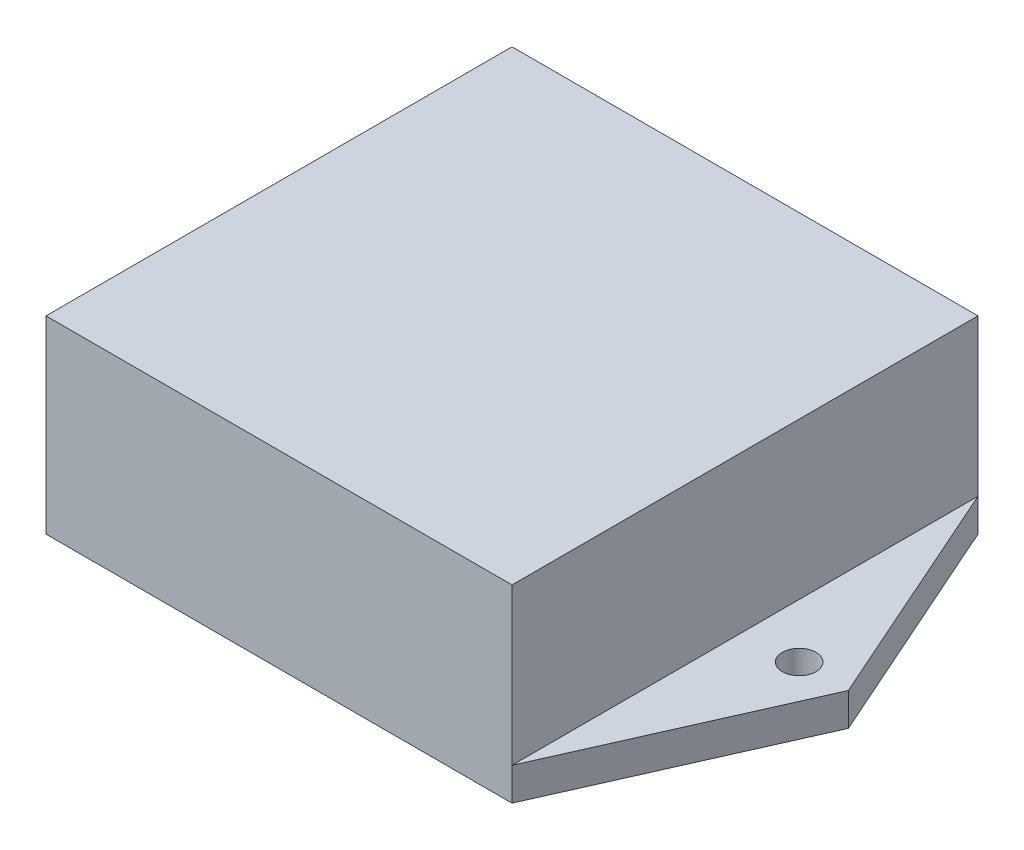
from build123d import *

# Parameters (mm, degrees)
BOSS_EXTRUDE1_DEPTH     = 2
SKETCH1_3_W             = 28.4
SKETCH1_3_H             = 28.4
BOSS_EXTRUDE2_DEPTH     = 11.52
M2_5_TAPPED_HOLE1_D     = 2.05
M2_5_TAPPED_HOLE1_DEPTH = 6.35
M2_5_TAPPED_HOLE1_TIP   = 0.615882135


with BuildPart() as part:
    # Sketch1 → Boss-Extrude1 (new body)
    with BuildSketch(Plane(origin=(0, 0, 0), x_dir=(1, 0, 0), z_dir=(0, 1, 0))):
        Polygon((-14.2, -14.2), (14.2, -14.2), (20.5, 0), (14.2, 14.2), (-14.2, 14.2), (-20.5, 0), align=None)
    extrude(amount=BOSS_EXTRUDE1_DEPTH)

    # Sketch1<3> → Boss-Extrude2 (add)
    with BuildSketch(Plane(origin=(0, 0, 0), x_dir=(1, 0, 0), z_dir=(0, 1, 0))):
        Rectangle(SKETCH1_3_W, SKETCH1_3_H)
    extrude(amount=BOSS_EXTRUDE2_DEPTH)

    # M2.5 Tapped Hole1
    with Locations(Plane(origin=(0, 2, 0), x_dir=(1, 0, 0), z_dir=(0, 1, 0))):
        with Locations((-17.5, 0), (17.5, 0)):
            Hole(M2_5_TAPPED_HOLE1_D / 2, depth=M2_5_TAPPED_HOLE1_DEPTH)
            with Locations((0, 0, -(M2_5_TAPPED_HOLE1_DEPTH + M2_5_TAPPED_HOLE1_TIP / 2))):  # 118° drill point
                Cone(0, M2_5_TAPPED_HOLE1_D / 2, M2_5_TAPPED_HOLE1_TIP, mode=Mode.SUBTRACT)


solid = part.part
